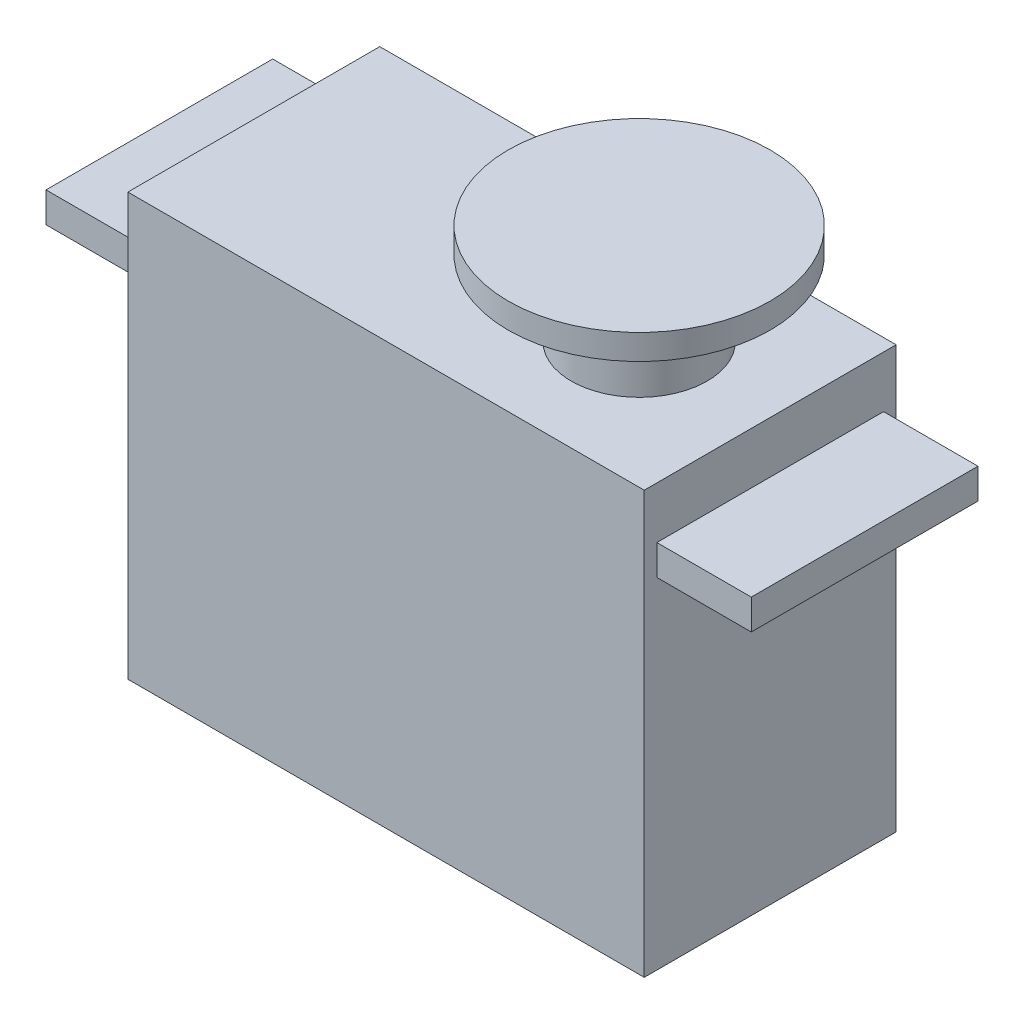
from build123d import *

# Parameters (mm, degrees)
SKETCH1_W           = 41
SKETCH1_H           = 33.5
BOSS_EXTRUDE1_DEPTH = 20
SKETCH3_W           = 18
SKETCH3_H           = 2.4
BOSS_EXTRUDE2_DEPTH = 7.5


with BuildPart() as part:
    # Sketch1 → Boss-Extrude1 (new body)
    with BuildSketch(Plane.XY):
        with Locations((20.5, 16.75)):
            Rectangle(SKETCH1_W, SKETCH1_H)
    extrude(amount=BOSS_EXTRUDE1_DEPTH)

    # Sketch3 → Boss-Extrude2 (add)
    with BuildSketch(Plane(origin=(41, 0, 0), x_dir=(0, 0, -1), z_dir=(1, 0, 0))):
        with Locations((-10, 28.2)):
            Rectangle(SKETCH3_W, SKETCH3_H)
    boss_extrude2 = extrude(amount=BOSS_EXTRUDE2_DEPTH)

    # Mirror1: Boss-Extrude2 across plane
    add(boss_extrude2.mirror(Plane(origin=(20.5, 0, 0), x_dir=(0, 0, 1), z_dir=(1, 0, 0))))

    # Sketch5 → Revolve1 (revolve)
    with BuildSketch(Plane.XY.offset(10), mode=Mode.PRIVATE) as revolve1_sk:
        Polygon((30.6, 33.5), (30.6, 41.5), (41, 41.5), (41, 39.5), (36, 39.5), (36, 33.5), align=None)
    revolve(revolve1_sk.sketch.rotate(Axis((30.6, 33.5, 10), (0, 1, 0)), 90), axis=Axis((30.6, 33.5, 10), (0, 1, 0)))


solid = part.part
